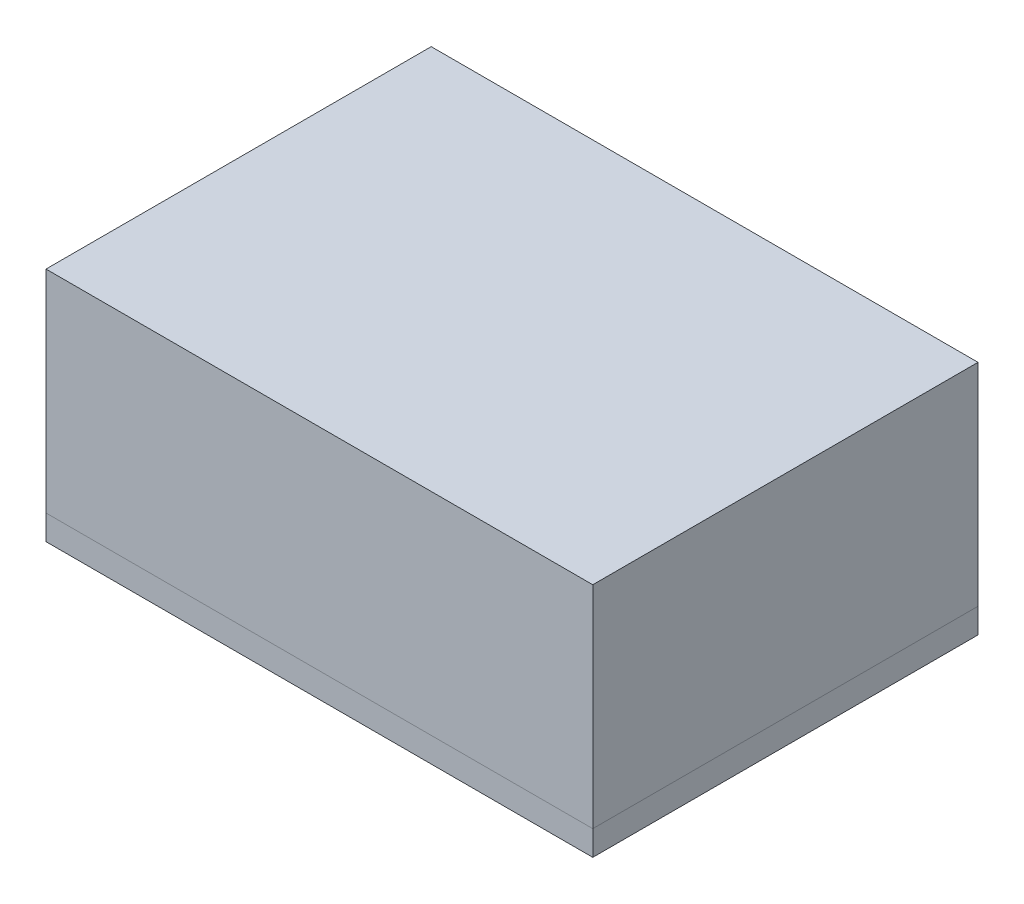
from build123d import *

# Parameters (mm, degrees)
SKETCH_1_W      = 22
SKETCH_1_H      = 15.5
EXTRUDE_1_DEPTH = 1
EXTRUDE_2_DEPTH = 5
SKETCH_3_W      = 22
SKETCH_3_H      = 15.5
SKETCH_3_W_2    = 20
SKETCH_3_H_2    = 13.5
EXTRUDE_3_DEPTH = 2
SKETCH_4_W      = 22
SKETCH_4_H      = 15.5
EXTRUDE_4_DEPTH = 1.5


with BuildPart() as part:
    # 草图1 → 凸台-拉伸1 (new body)
    with BuildSketch(Plane(origin=(0, 0, 0), x_dir=(1, 0, 0), z_dir=(0, 1, 0))):
        with Locations((11, -7.75)):
            Rectangle(SKETCH_1_W, SKETCH_1_H)
    extrude(amount=EXTRUDE_1_DEPTH)

    # 草图2 → 凸台-拉伸2 (add)
    with BuildSketch(Plane(origin=(0, 1, 0), x_dir=(1, 0, 0), z_dir=(0, 1, 0))):
        Polygon((4.95, -1), (4.95, 0), (0, 0), (0, -1.5), (0, -15.5), (1.5, -15.5), (11, -15.5), (11, -14.5), (1, -14.5), (1, -1), align=None)
        Polygon((22, 0), (17.05, 0), (17.05, -1), (21, -1), (21, -14.5), (11, -14.5), (11, -15.5), (20.5, -15.5), (22, -15.5), (22, -1.5), align=None)
    extrude(amount=EXTRUDE_2_DEPTH)

    # 草图3 → 凸台-拉伸3 (add)
    with BuildSketch(Plane(origin=(0, 6, 0), x_dir=(1, 0, 0), z_dir=(0, 1, 0))):
        with Locations((11, -7.75)):
            Rectangle(SKETCH_3_W, SKETCH_3_H)
        with Locations((11, -7.75)):
            Rectangle(SKETCH_3_W_2, SKETCH_3_H_2, mode=Mode.SUBTRACT)
    extrude(amount=EXTRUDE_3_DEPTH)

    # 草图4 → 凸台-拉伸4 (add)
    with BuildSketch(Plane(origin=(0, 8, 0), x_dir=(1, 0, 0), z_dir=(0, 1, 0))):
        with Locations((11, -7.75)):
            Rectangle(SKETCH_4_W, SKETCH_4_H)
    extrude(amount=EXTRUDE_4_DEPTH)


with BuildPart() as body_2:
    # Split Bodies 1: the piece on the far side of the plane
    add(part.part)
    split(bisect_by=Plane(origin=(0, 1, 0), x_dir=(0, 0, -1), z_dir=(0, -1, 0)), keep=Keep.BOTTOM)


with BuildPart() as part_1:
    add(part.part)

    # Split Bodies 1
    split(bisect_by=Plane(origin=(0, 1, 0), x_dir=(0, 0, -1), z_dir=(0, -1, 0)), keep=Keep.TOP)


solid = Compound([body_2.part, part_1.part])
